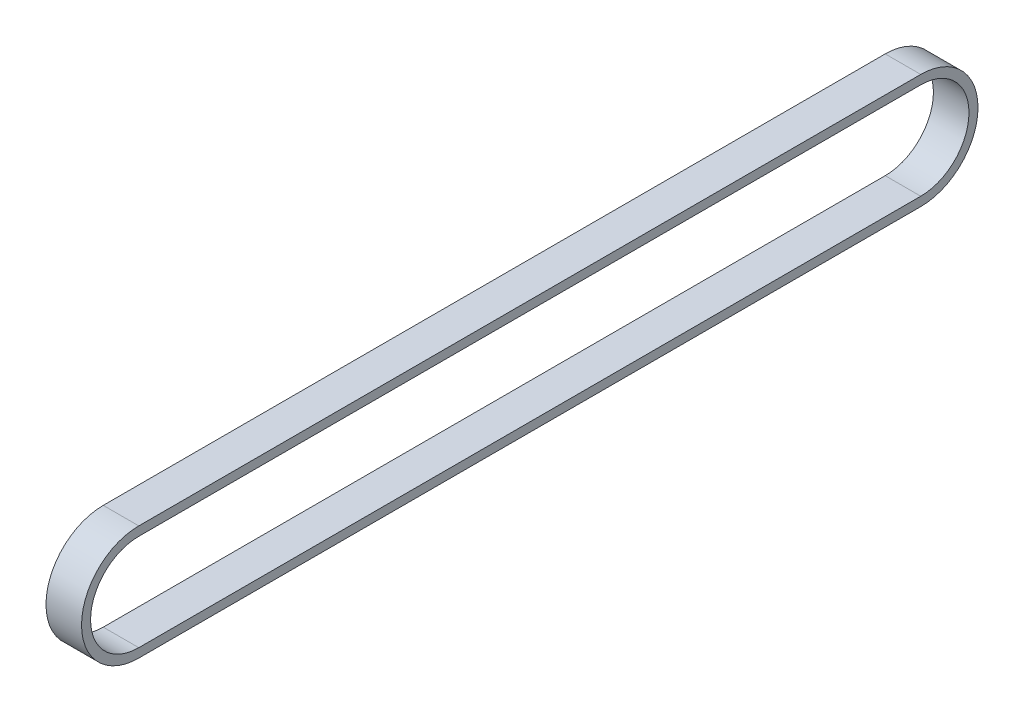
from build123d import *

# Parameters (mm, degrees)
BOSS_EXTRUDE1_DEPTH = 15


with BuildPart() as part:
    # Sketch1 → Boss-Extrude1 (new body)
    with BuildSketch(Plane(origin=(0, 0, 0), x_dir=(0, 0, -1), z_dir=(1, 0, 0))):
        with BuildLine():
            Line((329.999993796, 24.161291614), (0, 24.161291614))
            ThreePointArc((0, 24.161291614), (-24.161291614, 0), (0, -24.161291614))
            Line((0, -24.161291614), (329.999993796, -24.161291614))
            ThreePointArc((329.999993796, -24.161291614), (354.16128541, 0), (329.999993796, 24.161291614))
        make_face()
        with BuildLine():
            Line((329.999993796, 20.351291614), (0, 20.351291614))
            ThreePointArc((0, 20.351291614), (-20.351291614, 0), (0, -20.351291614))
            Line((0, -20.351291614), (329.999993796, -20.351291614))
            ThreePointArc((329.999993796, -20.351291614), (350.35128541, 0), (329.999993796, 20.351291614))
        make_face(mode=Mode.SUBTRACT)
    extrude(amount=BOSS_EXTRUDE1_DEPTH)


solid = part.part
